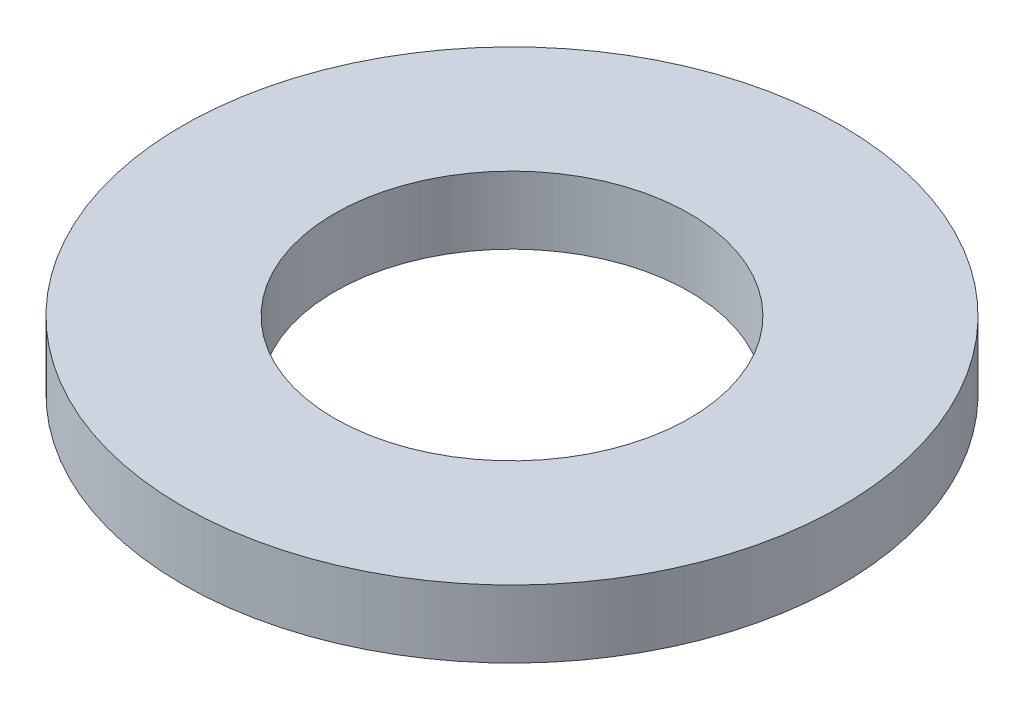
from build123d import *

# Parameters (mm, degrees)
SKETCH1_R           = 4.875
SKETCH1_R_2         = 2.625
BOSS_EXTRUDE1_DEPTH = 1


with BuildPart() as part:
    # Sketch1 → Boss-Extrude1 (new body)
    with BuildSketch(Plane(origin=(0, 0, 0), x_dir=(1, 0, 0), z_dir=(0, 1, 0))):
        with Locations(Location((0, 0, 0), (0, 0, 270))):
            Circle(SKETCH1_R)
        with Locations(Location((0, 0, 0), (0, 0, 270))):
            Circle(SKETCH1_R_2, mode=Mode.SUBTRACT)
    extrude(amount=BOSS_EXTRUDE1_DEPTH)


solid = part.part
